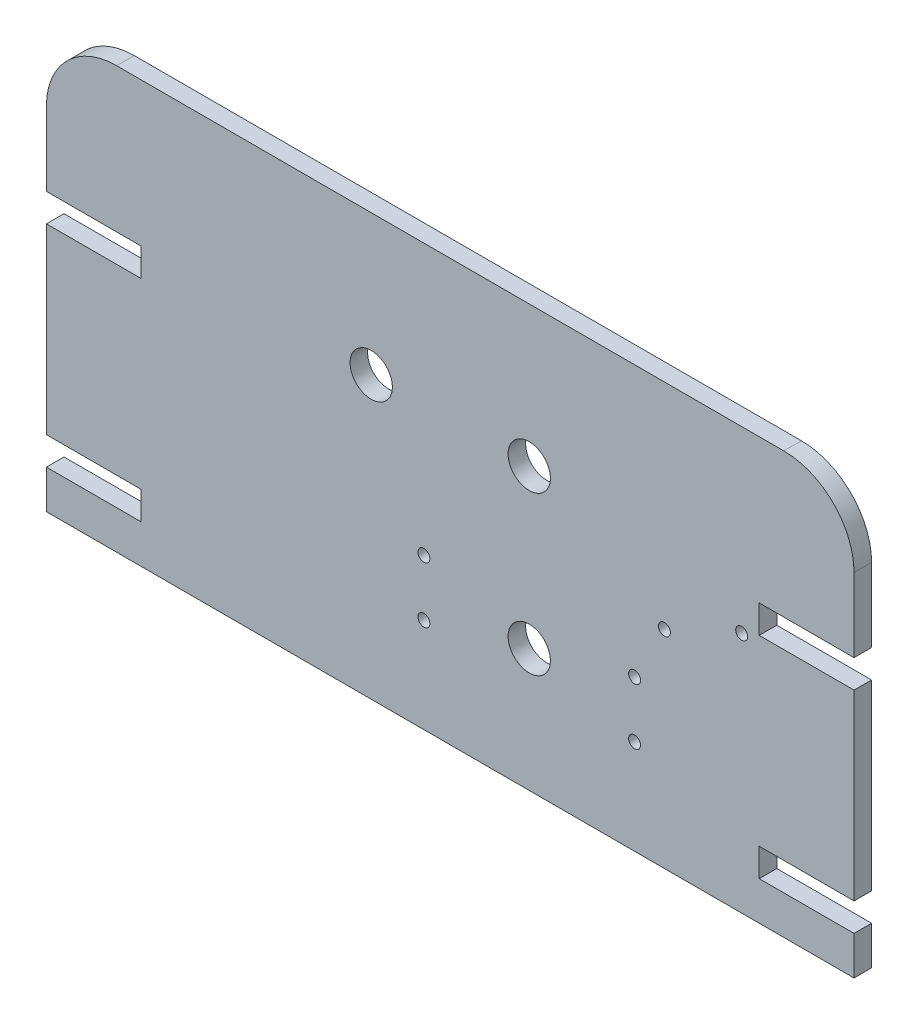
from build123d import *

# Parameters (mm, degrees)
SKETCH1_W            = 230
SKETCH1_H            = 120
BOSS_EXTRUDE1_DEPTH  = 5
CUT_EXTRUDE1_REACH   = 131.808
SKETCH2_W            = 27
SKETCH2_H            = 8.000000001
CUT_EXTRUDE2_REACH   = 131.808
SKETCH3_R            = 6.025
M3_CLEARANCE_HOLE1_D = 3.4
FILLET1_R            = 20
CUT_EXTRUDE3_REACH   = 131.808
SKETCH7_R            = 1.7


with BuildPart() as part:
    # Sketch1 → Boss-Extrude1 (new body)
    with BuildSketch(Plane.XY):
        Rectangle(SKETCH1_W, SKETCH1_H)
    extrude(amount=BOSS_EXTRUDE1_DEPTH)

    # Sketch2 → Cut-Extrude1 (cut, up to next)
    with BuildSketch(Plane(origin=(0, 0, 0), x_dir=(-1, 0, 0), z_dir=(0, 0, -1)), mode=Mode.PRIVATE) as cut_extrude1_sk1:
        with Locations((101.5, 15.000000001)):
            Rectangle(SKETCH2_W, SKETCH2_H)
    cut_extrude1_tool1 = extrude(cut_extrude1_sk1.sketch, amount=-CUT_EXTRUDE1_REACH, mode=Mode.PRIVATE) & part.part
    # Sketch2 → Cut-Extrude1 (cut, up to next)
    with BuildSketch(Plane(origin=(0, 0, 0), x_dir=(-1, 0, 0), z_dir=(0, 0, -1)), mode=Mode.PRIVATE) as cut_extrude1_sk2:
        with Locations((101.5, -45.000000001)):
            Rectangle(SKETCH2_W, SKETCH2_H)
    cut_extrude1_tool2 = extrude(cut_extrude1_sk2.sketch, amount=-CUT_EXTRUDE1_REACH, mode=Mode.PRIVATE) & part.part
    # Sketch2 → Cut-Extrude1 (cut, up to next)
    with BuildSketch(Plane(origin=(0, 0, 0), x_dir=(-1, 0, 0), z_dir=(0, 0, -1)), mode=Mode.PRIVATE) as cut_extrude1_sk3:
        with Locations((-101.5, -45.000000001)):
            Rectangle(SKETCH2_W, SKETCH2_H)
    cut_extrude1_tool3 = extrude(cut_extrude1_sk3.sketch, amount=-CUT_EXTRUDE1_REACH, mode=Mode.PRIVATE) & part.part
    # Sketch2 → Cut-Extrude1 (cut, up to next)
    with BuildSketch(Plane(origin=(0, 0, 0), x_dir=(-1, 0, 0), z_dir=(0, 0, -1)), mode=Mode.PRIVATE) as cut_extrude1_sk4:
        with Locations((-101.5, 15.000000001)):
            Rectangle(SKETCH2_W, SKETCH2_H)
    cut_extrude1_tool4 = extrude(cut_extrude1_sk4.sketch, amount=-CUT_EXTRUDE1_REACH, mode=Mode.PRIVATE) & part.part
    add(cut_extrude1_tool1.solids().sort_by_distance((-101.5, 15, 0))[0], mode=Mode.SUBTRACT)
    add(cut_extrude1_tool2.solids().sort_by_distance((-101.5, -45, 0))[0], mode=Mode.SUBTRACT)
    add(cut_extrude1_tool3.solids().sort_by_distance((101.5, -45, 0))[0], mode=Mode.SUBTRACT)
    add(cut_extrude1_tool4.solids().sort_by_distance((101.5, 15, 0))[0], mode=Mode.SUBTRACT)

    # Sketch3 → Cut-Extrude2 (cut, up to next)
    with BuildSketch(Plane.XY.offset(5), mode=Mode.PRIVATE) as cut_extrude2_sk1:
        with Locations((22.5, 20)):
            Circle(SKETCH3_R)
    cut_extrude2_tool1 = extrude(cut_extrude2_sk1.sketch, amount=-CUT_EXTRUDE2_REACH, mode=Mode.PRIVATE) & part.part
    # Sketch3 → Cut-Extrude2 (cut, up to next)
    with BuildSketch(Plane.XY.offset(5), mode=Mode.PRIVATE) as cut_extrude2_sk2:
        with Locations((-22.5, 20)):
            Circle(SKETCH3_R)
    cut_extrude2_tool2 = extrude(cut_extrude2_sk2.sketch, amount=-CUT_EXTRUDE2_REACH, mode=Mode.PRIVATE) & part.part
    # Sketch3 → Cut-Extrude2 (cut, up to next)
    with BuildSketch(Plane.XY.offset(5), mode=Mode.PRIVATE) as cut_extrude2_sk3:
        with Locations((22.5, -25)):
            Circle(SKETCH3_R)
    cut_extrude2_tool3 = extrude(cut_extrude2_sk3.sketch, amount=-CUT_EXTRUDE2_REACH, mode=Mode.PRIVATE) & part.part
    add(cut_extrude2_tool1.solids().sort_by_distance((22.5, 20, 5))[0], mode=Mode.SUBTRACT)
    add(cut_extrude2_tool2.solids().sort_by_distance((-22.5, 20, 5))[0], mode=Mode.SUBTRACT)
    add(cut_extrude2_tool3.solids().sort_by_distance((22.5, -25, 5))[0], mode=Mode.SUBTRACT)

    # M3 Clearance Hole1 (through all)
    with Locations(Plane(origin=(-7.5, -17, 5), x_dir=(1, 0, 0), z_dir=(0, 0, 1))):
        with Locations((0, 0), (60, 0), (60, -16), (0, -16)):
            Hole(M3_CLEARANCE_HOLE1_D / 2)

    # Fillet1
    fillet1_edges = [part.edges().sort_by_distance(p)[0] for p in [
        (-115, 60, 2.5),
        (115, 60, 2.5),
    ]]
    fillet(fillet1_edges, radius=FILLET1_R)

    # Sketch7 → Cut-Extrude3 (cut, up to next)
    with BuildSketch(Plane.XY.offset(5), mode=Mode.PRIVATE) as cut_extrude3_sk1:
        with Locations((61, -1)):
            Circle(SKETCH7_R)
    cut_extrude3_tool1 = extrude(cut_extrude3_sk1.sketch, amount=-CUT_EXTRUDE3_REACH, mode=Mode.PRIVATE) & part.part
    # Sketch7 → Cut-Extrude3 (cut, up to next)
    with BuildSketch(Plane.XY.offset(5), mode=Mode.PRIVATE) as cut_extrude3_sk2:
        with Locations((83, 9)):
            Circle(SKETCH7_R)
    cut_extrude3_tool2 = extrude(cut_extrude3_sk2.sketch, amount=-CUT_EXTRUDE3_REACH, mode=Mode.PRIVATE) & part.part
    add(cut_extrude3_tool1.solids().sort_by_distance((61, -1, 5))[0], mode=Mode.SUBTRACT)
    add(cut_extrude3_tool2.solids().sort_by_distance((83, 9, 5))[0], mode=Mode.SUBTRACT)


solid = part.part
